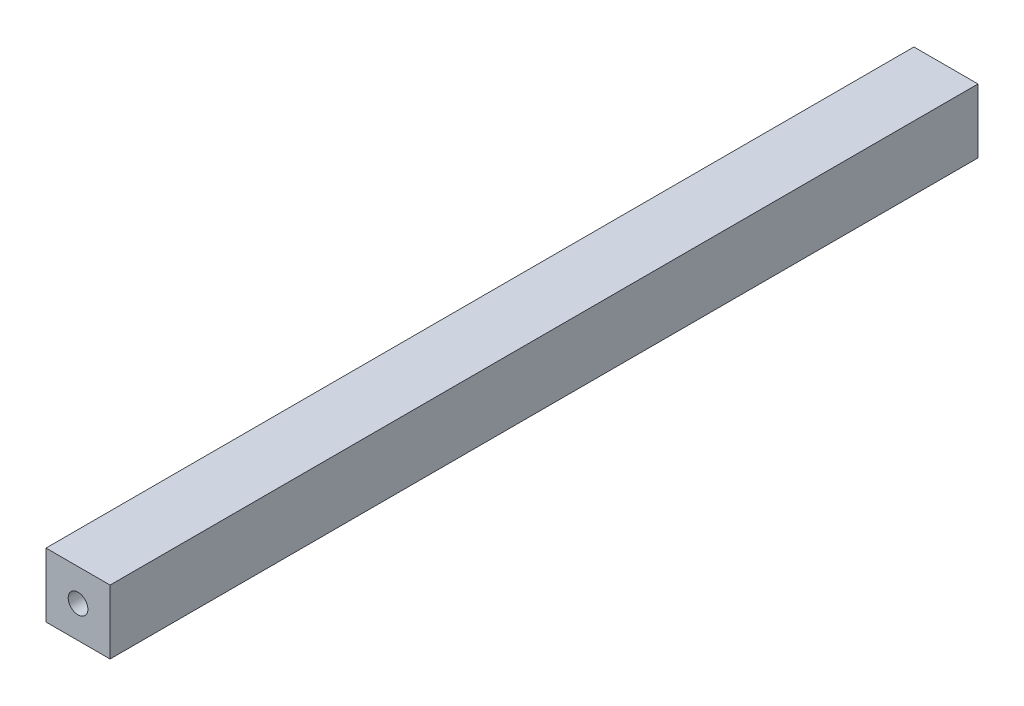
from build123d import *

# Parameters (mm, degrees)
ESQUISSE1_W             = 22
ESQUISSE1_H             = 22
BASE_EXTRUSION_DEPTH    = 298
ESQUISSE2_R             = 3.375
ENL_V_MAT_EXTRU_1_DEPTH = 25
ENL_V_START             = -25
ESQUISSE3_R             = 3.375
ENL_V_MAT_EXTRU_2_DEPTH = 25


with BuildPart() as part:
    # Esquisse1 → Base-Extrusion (new body)
    with BuildSketch(Plane.XY):
        with Locations((11, 11)):
            Rectangle(ESQUISSE1_W, ESQUISSE1_H)
    extrude(amount=BASE_EXTRUSION_DEPTH)

    # Esquisse2 → Enlèv. mat.-Extru.1 (cut)
    with BuildSketch(Plane.XY.offset(298)):
        with Locations((11, 11)):
            Circle(ESQUISSE2_R)
    extrude(amount=-ENL_V_MAT_EXTRU_1_DEPTH, mode=Mode.SUBTRACT)

    # Esquisse3 → Enlèv. mat.-Extru.2 (cut)
    with BuildSketch(Plane(origin=(0, 0, 0), x_dir=(-1, 0, 0), z_dir=(0, 0, -1)).offset(ENL_V_START)):
        with Locations(Location((-11, 11, 0), (0, 0, 180))):
            Circle(ESQUISSE3_R)
    extrude(amount=ENL_V_MAT_EXTRU_2_DEPTH, mode=Mode.SUBTRACT)


solid = part.part
